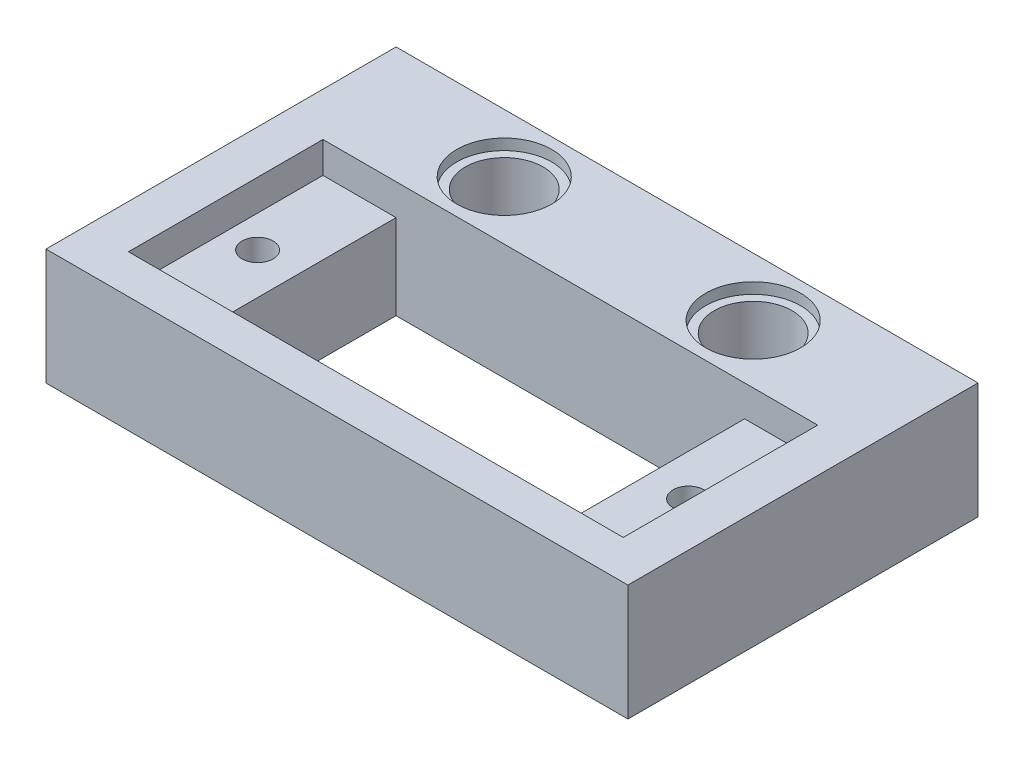
from build123d import *

# Parameters (mm, degrees)
SKETCH1_W           = 37.4
SKETCH1_H           = 22.5
SKETCH1_R           = 1
SKETCH1_W_2         = 22.4
SKETCH1_H_2         = 12.5
BOSS_EXTRUDE1_DEPTH = 7.46
SKETCH2_W           = 31.8
SKETCH2_H           = 12.5
CUT_EXTRUDE1_DEPTH  = 2
SKETCH3_R           = 2.5
CUT_EXTRUDE2_DEPTH  = 25.380404016
SKETCH4_R           = 3.05
CUT_EXTRUDE3_DEPTH  = 0.7
CUT_EXTRUDE4_START  = -0.7
SKETCH5_R           = 3.05
CUT_EXTRUDE4_DEPTH  = 0.7


with BuildPart() as part:
    # Sketch1 → Boss-Extrude1 (new body)
    with BuildSketch(Plane(origin=(0, 0, 0), x_dir=(1, 0, 0), z_dir=(0, 1, 0))):
        with Locations((0, 2.5)):
            Rectangle(SKETCH1_W, SKETCH1_H)
        with Locations(Location((13.85, 0, 0), (0, 0, 270))):
            Circle(SKETCH1_R, mode=Mode.SUBTRACT)
        with Locations(Location((-13.85, 0, 0), (0, 0, 270))):
            Circle(SKETCH1_R, mode=Mode.SUBTRACT)
        Rectangle(SKETCH1_W_2, SKETCH1_H_2, mode=Mode.SUBTRACT)
    extrude(amount=-BOSS_EXTRUDE1_DEPTH)

    # Sketch2 → Cut-Extrude1 (cut)
    with BuildSketch(Plane(origin=(0, 0, 0), x_dir=(1, 0, 0), z_dir=(0, 1, 0))):
        Rectangle(SKETCH2_W, SKETCH2_H)
    extrude(amount=-CUT_EXTRUDE1_DEPTH, mode=Mode.SUBTRACT)

    # Sketch3 → Cut-Extrude2 (cut, through all)
    with BuildSketch(Plane(origin=(0, 0, 0), x_dir=(1, 0, 0), z_dir=(0, 1, 0))):
        with Locations(Location((8, 10, 0), (0, 0, 270))):
            Circle(SKETCH3_R)
        with Locations(Location((-8, 10, 0), (0, 0, 270))):
            Circle(SKETCH3_R)
    extrude(amount=-CUT_EXTRUDE2_DEPTH, mode=Mode.SUBTRACT)

    # Sketch4 → Cut-Extrude3 (cut)
    with BuildSketch(Plane(origin=(0, 0, 0), x_dir=(1, 0, 0), z_dir=(0, 1, 0))):
        with Locations(Location((-8, 10, 0), (0, 0, 270))):
            Circle(SKETCH4_R)
        with Locations(Location((8, 10, 0), (0, 0, 270))):
            Circle(SKETCH4_R)
    extrude(amount=-CUT_EXTRUDE3_DEPTH, mode=Mode.SUBTRACT)

    # Sketch5 → Cut-Extrude4 (cut)
    with BuildSketch(Plane(origin=(0, -7.46, 0), x_dir=(-1, 0, 0), z_dir=(0, -1, 0)).offset(CUT_EXTRUDE4_START)):
        with Locations(Location((-8, 10, 0), (0, 0, 270))):
            Circle(SKETCH5_R)
        with Locations(Location((8, 10, 0), (0, 0, 270))):
            Circle(SKETCH5_R)
    extrude(amount=CUT_EXTRUDE4_DEPTH, mode=Mode.SUBTRACT)


solid = part.part
